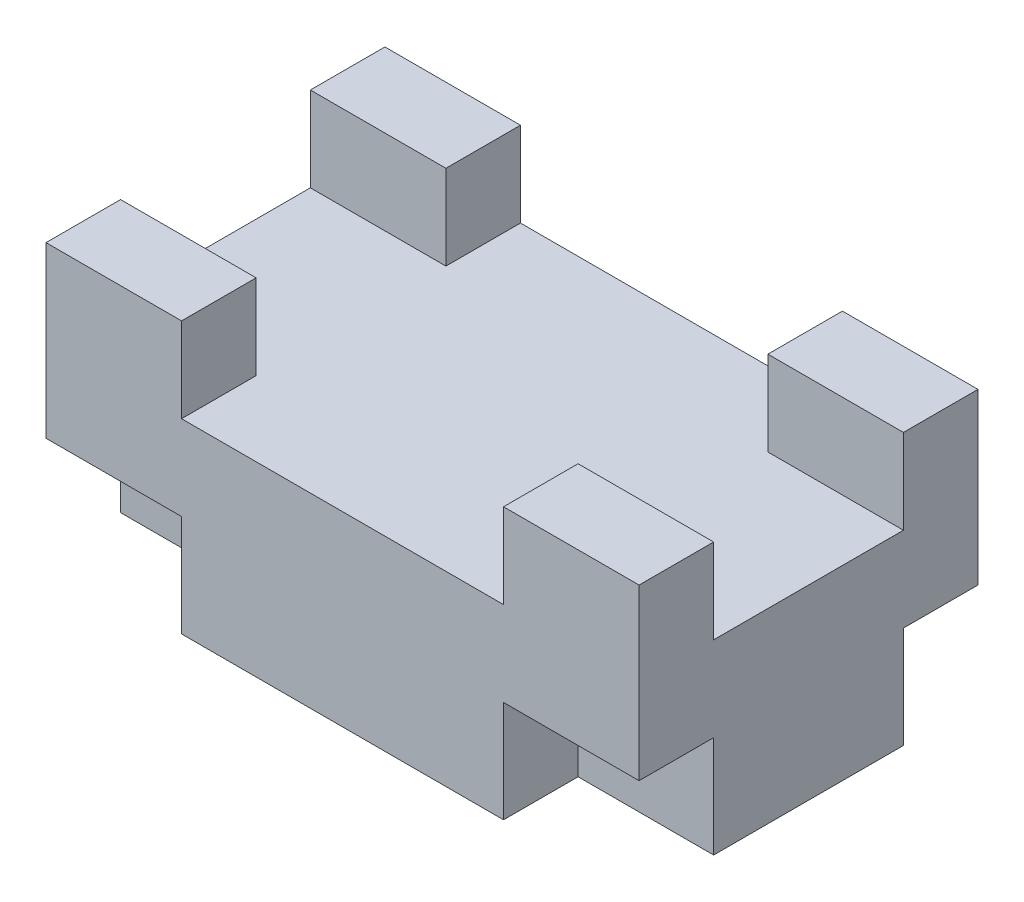
from build123d import *

# Parameters (mm, degrees)
SZKIC2_W                    = 175
SZKIC2_H                    = 100
DODANIE_WYCI_GNI_CIE1_DEPTH = 55
SZKIC3_W                    = 40
SZKIC3_H                    = 22
DODANIE_WYCI_GNI_CIE2_DEPTH = 25
SZKIC4_W                    = 40
SZKIC4_H                    = 22
WYTNIJ_WYCI_GNI_CIE1_DEPTH  = 30


with BuildPart() as part:
    # Szkic2 → Dodanie-wyciągnięcie1 (new body)
    with BuildSketch(Plane(origin=(0, 0, 0), x_dir=(1, 0, 0), z_dir=(0, 1, 0))):
        Rectangle(SZKIC2_W, SZKIC2_H)
    extrude(amount=DODANIE_WYCI_GNI_CIE1_DEPTH)

    # Szkic3 → Dodanie-wyciągnięcie2 (add)
    with BuildSketch(Plane(origin=(0, 55, 0), x_dir=(1, 0, 0), z_dir=(0, 1, 0))):
        with Locations((67.5, 39)):
            Rectangle(SZKIC3_W, SZKIC3_H)
        with Locations((-67.5, 39)):
            Rectangle(SZKIC3_W, SZKIC3_H)
        with Locations((67.5, -39)):
            Rectangle(SZKIC3_W, SZKIC3_H)
        with Locations((-67.5, -39)):
            Rectangle(SZKIC3_W, SZKIC3_H)
    extrude(amount=DODANIE_WYCI_GNI_CIE2_DEPTH)

    # Szkic4 → Wytnij-wyciągnięcie1 (cut)
    with BuildSketch(Plane.XZ):
        with Locations((-67.5, 39)):
            Rectangle(SZKIC4_W, SZKIC4_H)
        with Locations((67.5, 39)):
            Rectangle(SZKIC4_W, SZKIC4_H)
        with Locations((67.5, -39)):
            Rectangle(SZKIC4_W, SZKIC4_H)
        with Locations((-67.5, -39)):
            Rectangle(SZKIC4_W, SZKIC4_H)
    extrude(amount=-WYTNIJ_WYCI_GNI_CIE1_DEPTH, mode=Mode.SUBTRACT)


solid = part.part
